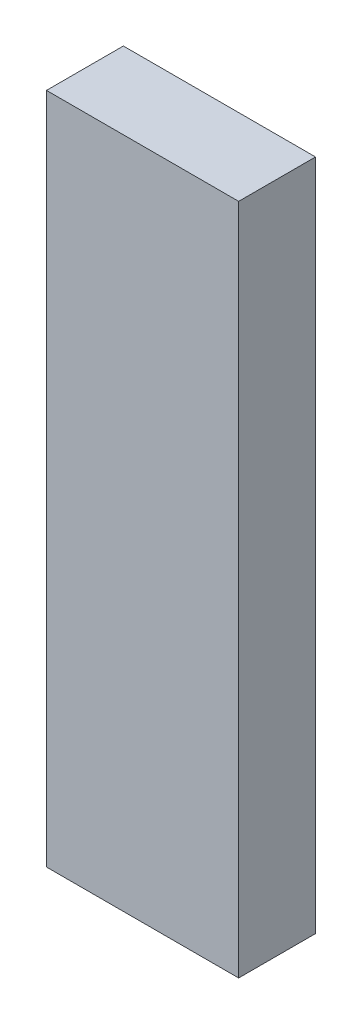
from build123d import *

# Parameters (mm, degrees)
SKETCH1_W           = 50.8
SKETCH1_H           = 20.32
BOSS_EXTRUDE1_DEPTH = 177.8


with BuildPart() as part:
    # Sketch1 → Boss-Extrude1 (new body)
    with BuildSketch(Plane(origin=(0, 0, 0), x_dir=(1, 0, 0), z_dir=(0, 1, 0))):
        Rectangle(SKETCH1_W, SKETCH1_H)
    extrude(amount=BOSS_EXTRUDE1_DEPTH)


solid = part.part
